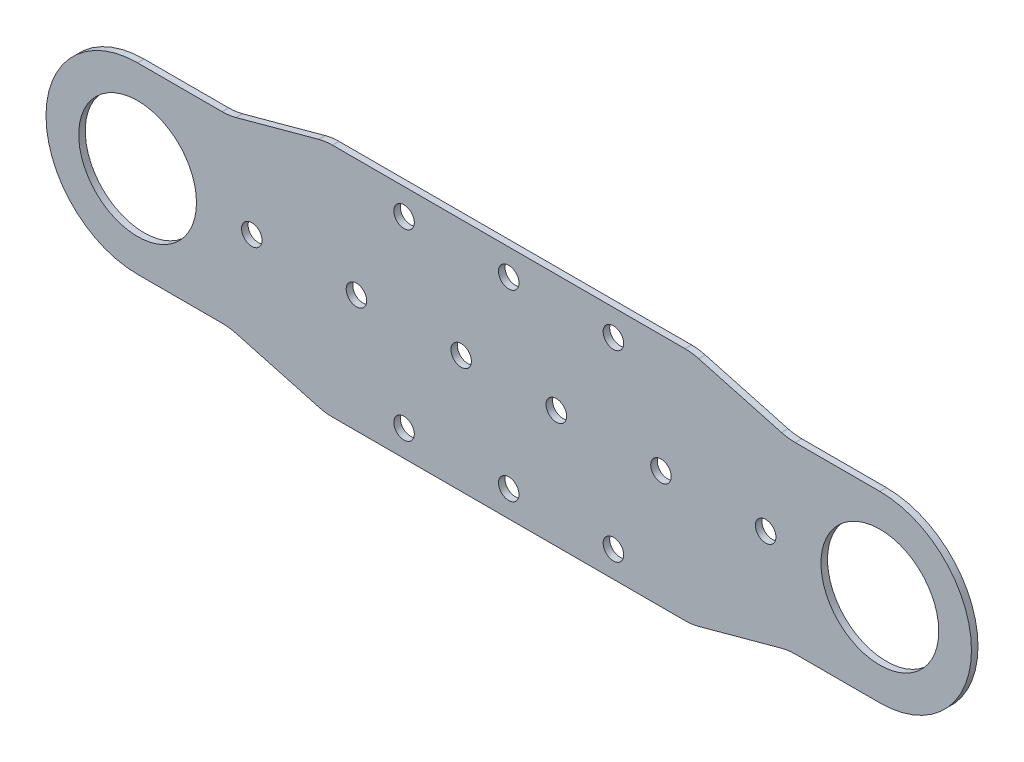
from build123d import *

# Parameters (mm, degrees)
SKETCH1_R              = 14.2875
BOSS_EXTRUDE1_DEPTH    = 1.5875
F_10_CLEARANCE_HOLE1_D = 4.9784
FILLET1_R              = 12.7


with BuildPart() as part:
    # Sketch1 → Boss-Extrude1 (new body)
    with BuildSketch(Plane.XY):
        with BuildLine():
            Line((0, 22.225), (22.225, 22.225))
            Line((22.225, 22.225), (45.6057, 28.575))
            Line((45.6057, 28.575), (134.5057, 28.575))
            Line((134.5057, 28.575), (157.8864, 22.225))
            Line((157.8864, 22.225), (180.1114, 22.225))
            ThreePointArc((180.1114, 22.225), (202.3364, 0), (180.1114, -22.225))
            Line((180.1114, -22.225), (157.8864, -22.225))
            Line((157.8864, -22.225), (134.5057, -28.575))
            Line((134.5057, -28.575), (45.6057, -28.575))
            Line((45.6057, -28.575), (22.225, -22.225))
            Line((22.225, -22.225), (0, -22.225))
            ThreePointArc((0, -22.225), (-22.225, 0), (0, 22.225))
        make_face()
        Circle(SKETCH1_R, mode=Mode.SUBTRACT)
        with Locations((180.1114, 0)):
            Circle(SKETCH1_R, mode=Mode.SUBTRACT)
    extrude(amount=BOSS_EXTRUDE1_DEPTH)

    # #10 Clearance Hole1 (through all)
    with Locations(Plane.XY.offset(1.5875)):
        with Locations((64.6557, -22.225), (27.7114, 0), (64.6557, 22.225), (90.0557, 22.225), (53.1114, 0), (78.5114, 0), (101.6, 0), (127, 0), (115.4557, 22.225), (152.4, 0), (115.4557, -22.225), (90.0557, -22.225)):
            Hole(F_10_CLEARANCE_HOLE1_D / 2)

    # Fillet1
    fillet1_edges = [part.edges().sort_by_distance(p)[0] for p in [
        (22.225, 22.225, 0.79375),
        (45.6057, 28.575, 0.79375),
        (134.5057, 28.575, 0.79375),
        (157.8864, 22.225, 0.79375),
        (157.8864, -22.225, 0.79375),
        (134.5057, -28.575, 0.79375),
        (45.6057, -28.575, 0.79375),
        (22.225, -22.225, 0.79375),
    ]]
    fillet(fillet1_edges, radius=FILLET1_R)


solid = part.part
